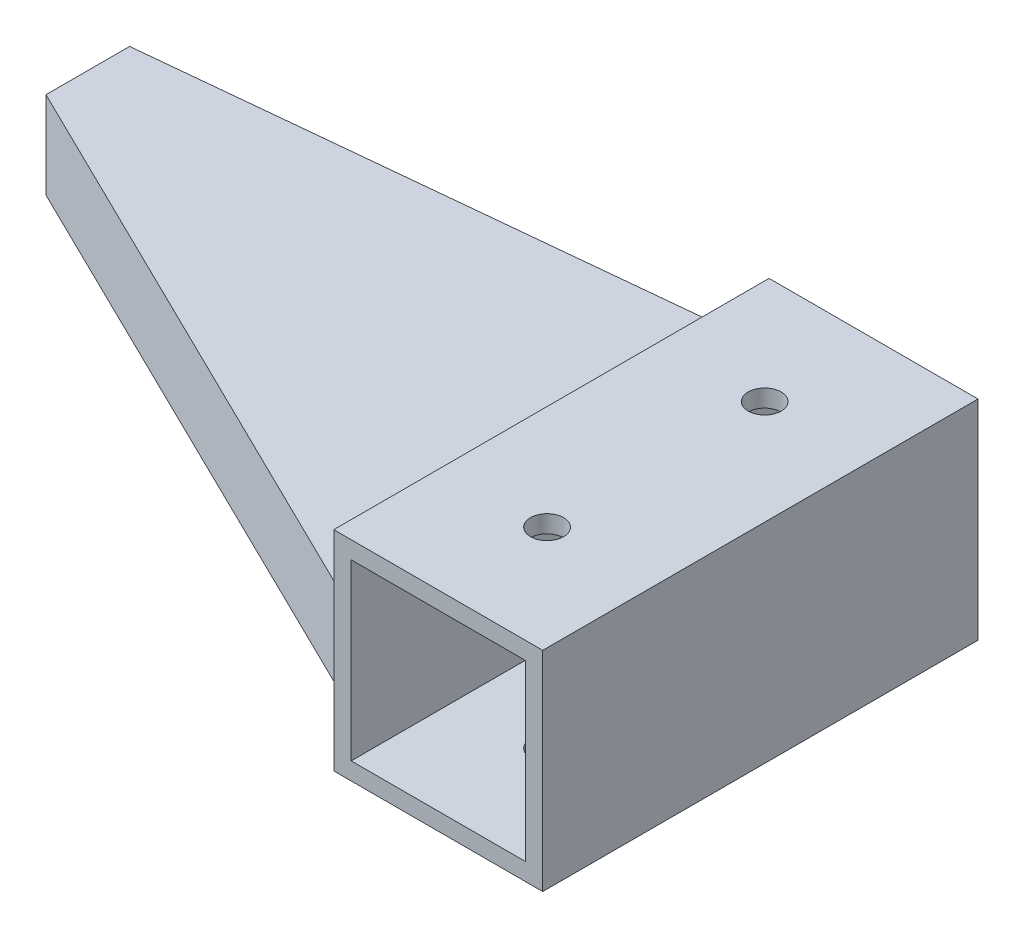
from build123d import *

# Parameters (mm, degrees)
BOSS_EXTRUDE1_DEPTH = 12.7
SKETCH2_R           = 3.556
CUT_EXTRUDE1_DEPTH  = 2.9972
SKETCH3_W           = 30.48
SKETCH3_H           = 30.48
SKETCH3_W_2         = 25.4
SKETCH3_H_2         = 25.4
BOSS_EXTRUDE2_DEPTH = 63.5
CUT_EXTRUDE2_REACH  = 114.231
SKETCH4_R           = 2.413
CUT_EXTRUDE3_DEPTH  = 12.7


with BuildPart() as part:
    # Sketch1 → Boss-Extrude1 (new body)
    with BuildSketch(Plane(origin=(0, 0, 0), x_dir=(1, 0, 0), z_dir=(0, 1, 0))):
        Polygon((-87.376, 0), (0, 0), (0, -63.5), (-87.376, -20.644), align=None)
    extrude(amount=BOSS_EXTRUDE1_DEPTH)

    # Sketch2 → Cut-Extrude1 (cut)
    with BuildSketch(Plane.ZY.offset(87.376)):
        with Locations((14.548, 6.35)):
            Circle(SKETCH2_R)
    extrude(amount=-CUT_EXTRUDE1_DEPTH, mode=Mode.SUBTRACT)

    # Sketch3 → Boss-Extrude2 (add)
    with BuildSketch(Plane(origin=(0, 0, 0), x_dir=(-1, 0, 0), z_dir=(0, 0, -1))):
        with Locations((-12.7, 6.35)):
            Rectangle(SKETCH3_W, SKETCH3_H)
        with Locations((-12.7, 6.35)):
            Rectangle(SKETCH3_W_2, SKETCH3_H_2, mode=Mode.SUBTRACT)
    extrude(amount=-BOSS_EXTRUDE2_DEPTH)

    # Cut-Extrude2: up to this face of the body (flat: up to its plane)
    cut_extrude2_end = Plane(part.part.faces().sort_by_distance((12.7, -8.89, 31.75))[0])
    # Sketch4 → Cut-Extrude2 (cut, up to the picked face)
    with BuildSketch(Plane(origin=(0, 21.59, 0), x_dir=(1, 0, 0), z_dir=(0, 1, 0)), mode=Mode.PRIVATE) as cut_extrude2_sk1:
        with Locations(Location((12.7, -15.875, 0), (0, 0, 270))):
            Circle(SKETCH4_R)
    cut_extrude2_tool1 = split(extrude(cut_extrude2_sk1.sketch, amount=-CUT_EXTRUDE2_REACH, mode=Mode.PRIVATE), bisect_by=cut_extrude2_end, keep=Keep.BOTH, mode=Mode.PRIVATE)
    # Sketch4 → Cut-Extrude2 (cut, up to the picked face)
    with BuildSketch(Plane(origin=(0, 21.59, 0), x_dir=(1, 0, 0), z_dir=(0, 1, 0)), mode=Mode.PRIVATE) as cut_extrude2_sk2:
        with Locations(Location((12.7, -47.625, 0), (0, 0, 270))):
            Circle(SKETCH4_R)
    cut_extrude2_tool2 = split(extrude(cut_extrude2_sk2.sketch, amount=-CUT_EXTRUDE2_REACH, mode=Mode.PRIVATE), bisect_by=cut_extrude2_end, keep=Keep.BOTH, mode=Mode.PRIVATE)
    add(cut_extrude2_tool1.solids().sort_by(Axis((12.7, 21.59, 15.875), (0, -1, 0)))[0], mode=Mode.SUBTRACT)
    add(cut_extrude2_tool2.solids().sort_by(Axis((12.7, 21.59, 47.625), (0, -1, 0)))[0], mode=Mode.SUBTRACT)

    # Sketch8 → Cut-Extrude3 (cut)
    with BuildSketch(Plane(origin=(0, 12.7, 0), x_dir=(1, 0, 0), z_dir=(0, 1, 0))):
        Polygon((-87.376, -8.452), (-2.54, 0), (-87.376, 0), align=None)
    extrude(amount=-CUT_EXTRUDE3_DEPTH, mode=Mode.SUBTRACT)


solid = part.part
